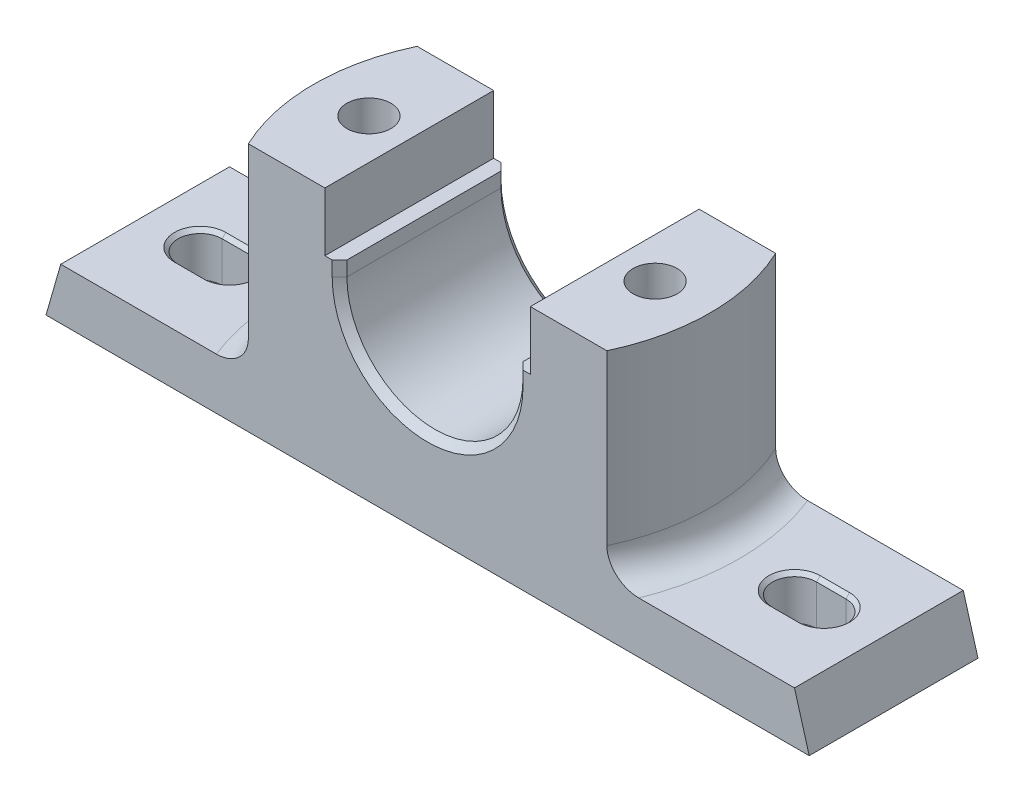
from build123d import *

# Parameters (mm, degrees)
BOSS_EXTRUDE1_DEPTH = 23
CUT_EXTRUDE1_DEPTH  = 76
CHAMFER1_SIZE       = 2
CUT_EXTRUDE2_START  = -68
SKETCH4_R           = 6
SKETCH4_W           = 28
SKETCH4_H           = 28
SKETCH4_W_2         = 3
CUT_EXTRUDE2_DEPTH  = 2
SKETCH4_3_R         = 6
CUT_EXTRUDE3_DEPTH  = 127.368508735
CUT_EXTRUDE4_START  = -66
SKETCH4_4_R         = 6
SKETCH4_4_W         = 28
SKETCH4_4_H         = 28
CUT_EXTRUDE4_DEPTH  = 10
CHAMFER2_SIZE       = 1
FILLET1_R           = 8


with BuildPart() as part:
    # Sketch1 → Boss-Extrude1 (new, symmetric)
    with BuildSketch(Plane.XY):
        with BuildLine():
            Line((-104, 0), (104, 0))
            Line((104, 0), (99.985564599, 14))
            Line((99.985564599, 14), (54, 14))
            Line((54, 14), (54, 68))
            Line((54, 68), (28, 68))
            Line((28, 68), (28, 52))
            Line((28, 52), (24, 52))
            Line((24, 52), (24, 48))
            ThreePointArc((24, 48), (0, 24), (-24, 48))
            Line((-24, 48), (-24, 52))
            Line((-24, 52), (-28, 52))
            Line((-28, 52), (-28, 68))
            Line((-28, 68), (-54, 68))
            Line((-54, 68), (-54, 14))
            Line((-54, 14), (-99.985564599, 14))
            Line((-99.985564599, 14), (-104, 0))
        make_face()
    extrude(amount=BOSS_EXTRUDE1_DEPTH, both=True)

    # Sketch3 → Cut-Extrude1 (cut)
    with BuildSketch(Plane(origin=(0, 14, 0), x_dir=(1, 0, 0), z_dir=(0, 1, 0))):
        with BuildLine():
            Line((-48.856934001, 23), (-54, 23))
            Line((-54, 23), (-54, 2.63e-07))
            ThreePointArc((-54, 2.63e-07), (-52.698550407, 11.784005473), (-48.856934001, 23))
        make_face()
        with BuildLine():
            ThreePointArc((-48.856934001, -23), (-52.698550464, -11.784005217), (-54, 2.63e-07))
            Line((-54, 2.63e-07), (-54, -23))
            Line((-54, -23), (-48.856934001, -23))
        make_face()
        with BuildLine():
            Line((48.856934001, -23), (54, -23))
            Line((54, -23), (54, 0))
            ThreePointArc((54, 0), (52.698550436, -11.784005345), (48.856934001, -23))
        make_face()
        with BuildLine():
            ThreePointArc((48.856934001, 23), (52.698550436, 11.784005345), (54, 0))
            Line((54, 0), (54, 23))
            Line((54, 23), (48.856934001, 23))
        make_face()
    extrude(amount=CUT_EXTRUDE1_DEPTH, mode=Mode.SUBTRACT)

    # Chamfer1
    chamfer1_edges = [part.edges().sort_by_distance(p)[0] for p in [
        (-24, 50, -23),
        (0, 24, -23),
        (24, 50, -23),
        (24, 50, 23),
        (0, 24, 23),
        (-24, 50, 23),
    ]]
    chamfer(chamfer1_edges, length=CHAMFER1_SIZE)

    # Sketch4 → Cut-Extrude2 (cut)
    # profile 1 of 14: a face of its own
    with BuildSketch(Plane(origin=(0, 68, 0), x_dir=(1, 0, 0), z_dir=(0, 1, 0)).offset(CUT_EXTRUDE2_START)):
        with BuildLine():
            Line((-53, 10.344080433), (-53, 14))
            Line((-53, 14), (-52.153619242, 14))
            ThreePointArc((-52.153619242, 14), (-51.649321328, 15.759048395), (-51.085712288, 17.5))
            Line((-51.085712288, 17.5), (-97.5, 17.5))
            Line((-97.5, 17.5), (-97.5, -17.5))
            Line((-97.5, -17.5), (-51.085712288, -17.5))
            ThreePointArc((-51.085712288, -17.5), (-51.649321328, -15.759048395), (-52.153619242, -14))
            Line((-52.153619242, -14), (-53, -14))
            Line((-53, -14), (-53, -10.344080433))
            ThreePointArc((-53, -10.344080433), (-54, 0), (-53, 10.344080433))
        make_face()
        with BuildLine():
            ThreePointArc((-85, -6), (-91, 0), (-85, 6))
            Line((-85, 6), (-77, 6))
            ThreePointArc((-77, 6), (-71, 0), (-77, -6))
            Line((-77, -6), (-85, -6))
        make_face(mode=Mode.SUBTRACT)
    # profile 2 of 14: a face of its own
    with BuildSketch(Plane(origin=(0, 68, 0), x_dir=(1, 0, 0), z_dir=(0, 1, 0)).offset(CUT_EXTRUDE2_START)):
        with BuildLine():
            Line((-28, 14), (-52.153619242, 14))
            ThreePointArc((-52.153619242, 14), (-52.608576743, 12.179394612), (-53, 10.344080433))
            Line((-53, 10.344080433), (-53, -10.344080433))
            ThreePointArc((-53, -10.344080433), (-52.608576743, -12.179394612), (-52.153619242, -14))
            Line((-52.153619242, -14), (-28, -14))
            Line((-28, -14), (-28, 14))
        make_face()
        with Locations((-39, 0)):
            Circle(SKETCH4_R, mode=Mode.SUBTRACT)
    # profile 3 of 14: a face of its own
    with BuildSketch(Plane(origin=(0, 68, 0), x_dir=(1, 0, 0), z_dir=(0, 1, 0)).offset(CUT_EXTRUDE2_START)):
        with Locations((-39, 0)):
            Circle(SKETCH4_R)
    # profile 4 of 14: a face of its own
    with BuildSketch(Plane(origin=(0, 68, 0), x_dir=(1, 0, 0), z_dir=(0, 1, 0)).offset(CUT_EXTRUDE2_START)):
        with BuildLine():
            Line((-85, -6), (-77, -6))
            ThreePointArc((-77, -6), (-71, 0), (-77, 6))
            Line((-77, 6), (-85, 6))
            ThreePointArc((-85, 6), (-91, 0), (-85, -6))
        make_face()
    # profile 5 of 14: a face of its own
    with BuildSketch(Plane(origin=(0, 68, 0), x_dir=(1, 0, 0), z_dir=(0, 1, 0)).offset(CUT_EXTRUDE2_START)):
        with BuildLine():
            Line((-28, -17.5), (-28, -14))
            Line((-28, -14), (-52.153619242, -14))
            ThreePointArc((-52.153619242, -14), (-51.649321328, -15.759048395), (-51.085712288, -17.5))
            Line((-51.085712288, -17.5), (-28, -17.5))
        make_face()
    # profile 6 of 14: a face of its own
    with BuildSketch(Plane(origin=(0, 68, 0), x_dir=(1, 0, 0), z_dir=(0, 1, 0)).offset(CUT_EXTRUDE2_START)):
        with BuildLine():
            ThreePointArc((-51.085712288, 17.5), (-51.649321328, 15.759048395), (-52.153619242, 14))
            Line((-52.153619242, 14), (-28, 14))
            Line((-28, 14), (-28, 17.5))
            Line((-28, 17.5), (-51.085712288, 17.5))
        make_face()
    # profile 7 of 14: a face of its own
    with BuildSketch(Plane(origin=(0, 68, 0), x_dir=(1, 0, 0), z_dir=(0, 1, 0)).offset(CUT_EXTRUDE2_START)):
        Polygon((-28, 17.5), (-28, 14), (-25, 14), (-25, -14), (-28, -14), (-28, -17.5), (97.5, -17.5), (97.5, 17.5), align=None)
        with Locations((39, 0)):
            Rectangle(SKETCH4_W, SKETCH4_H, mode=Mode.SUBTRACT)
        with BuildLine():
            Line((77, 6), (85, 6))
            ThreePointArc((85, 6), (91, 0), (85, -6))
            Line((85, -6), (77, -6))
            ThreePointArc((77, -6), (71, 0), (77, 6))
        make_face(mode=Mode.SUBTRACT)
    # profile 8 of 14: a face of its own
    with BuildSketch(Plane(origin=(0, 68, 0), x_dir=(1, 0, 0), z_dir=(0, 1, 0)).offset(CUT_EXTRUDE2_START)):
        with BuildLine():
            ThreePointArc((-52.153619242, -14), (-52.608576743, -12.179394612), (-53, -10.344080433))
            Line((-53, -10.344080433), (-53, -14))
            Line((-53, -14), (-52.153619242, -14))
        make_face()
    # profile 9 of 14: a face of its own
    with BuildSketch(Plane(origin=(0, 68, 0), x_dir=(1, 0, 0), z_dir=(0, 1, 0)).offset(CUT_EXTRUDE2_START)):
        with BuildLine():
            Line((-53, -10.344080433), (-53, 10.344080433))
            ThreePointArc((-53, 10.344080433), (-54, 0), (-53, -10.344080433))
        make_face()
    # profile 10 of 14: a face of its own
    with BuildSketch(Plane(origin=(0, 68, 0), x_dir=(1, 0, 0), z_dir=(0, 1, 0)).offset(CUT_EXTRUDE2_START)):
        with BuildLine():
            Line((-52.153619242, 14), (-53, 14))
            Line((-53, 14), (-53, 10.344080433))
            ThreePointArc((-53, 10.344080433), (-52.608576743, 12.179394612), (-52.153619242, 14))
        make_face()
    # profile 11 of 14: a face of its own
    with BuildSketch(Plane(origin=(0, 68, 0), x_dir=(1, 0, 0), z_dir=(0, 1, 0)).offset(CUT_EXTRUDE2_START)):
        with Locations((-26.5, 0)):
            Rectangle(SKETCH4_W_2, SKETCH4_H)
    # profile 12 of 14: a face of its own
    with BuildSketch(Plane(origin=(0, 68, 0), x_dir=(1, 0, 0), z_dir=(0, 1, 0)).offset(CUT_EXTRUDE2_START)):
        with BuildLine():
            ThreePointArc((77, -6), (71, 0), (77, 6))
            Line((77, 6), (85, 6))
            ThreePointArc((85, 6), (91, 0), (85, -6))
            Line((85, -6), (77, -6))
        make_face()
    # profile 13 of 14: a face of its own
    with BuildSketch(Plane(origin=(0, 68, 0), x_dir=(1, 0, 0), z_dir=(0, 1, 0)).offset(CUT_EXTRUDE2_START)):
        with Locations((39, 0)):
            Rectangle(SKETCH4_W, SKETCH4_H)
        with Locations((39, 0)):
            Circle(SKETCH4_R, mode=Mode.SUBTRACT)
    # profile 14 of 14: a face of its own
    with BuildSketch(Plane(origin=(0, 68, 0), x_dir=(1, 0, 0), z_dir=(0, 1, 0)).offset(CUT_EXTRUDE2_START)):
        with Locations((39, 0)):
            Circle(SKETCH4_R)
    extrude(amount=CUT_EXTRUDE2_DEPTH, mode=Mode.SUBTRACT)

    # Sketch4<3> → Cut-Extrude3 (cut, through all)
    with BuildSketch(Plane(origin=(0, 68, 0), x_dir=(1, 0, 0), z_dir=(0, 1, 0))):
        with Locations(Location((-39, 0, 0), (0, 0, 270))):
            Circle(SKETCH4_3_R)
        with Locations(Location((39, 0, 0), (0, 0, 270))):
            Circle(SKETCH4_3_R)
        with BuildLine():
            Line((-85, -6), (-77, -6))
            ThreePointArc((-77, -6), (-71, 0), (-77, 6))
            Line((-77, 6), (-85, 6))
            ThreePointArc((-85, 6), (-91, 0), (-85, -6))
        make_face()
        with BuildLine():
            ThreePointArc((77, -6), (71, 0), (77, 6))
            Line((77, 6), (85, 6))
            ThreePointArc((85, 6), (91, 0), (85, -6))
            Line((85, -6), (77, -6))
        make_face()
    extrude(amount=-CUT_EXTRUDE3_DEPTH, mode=Mode.SUBTRACT)

    # Sketch4<4> → Cut-Extrude4 (cut)
    # profile 1 of 4: a face of its own
    with BuildSketch(Plane(origin=(0, 68, 0), x_dir=(1, 0, 0), z_dir=(0, 1, 0)).offset(CUT_EXTRUDE4_START)):
        with BuildLine():
            Line((-28, 14), (-52.153619242, 14))
            ThreePointArc((-52.153619242, 14), (-52.608576743, 12.179394612), (-53, 10.344080433))
            Line((-53, 10.344080433), (-53, -10.344080433))
            ThreePointArc((-53, -10.344080433), (-52.608576743, -12.179394612), (-52.153619242, -14))
            Line((-52.153619242, -14), (-28, -14))
            Line((-28, -14), (-28, 14))
        make_face()
        with Locations(Location((-39, 0, 0), (0, 0, 270))):
            Circle(SKETCH4_4_R, mode=Mode.SUBTRACT)
    # profile 2 of 4: a face of its own
    with BuildSketch(Plane(origin=(0, 68, 0), x_dir=(1, 0, 0), z_dir=(0, 1, 0)).offset(CUT_EXTRUDE4_START)):
        with Locations((39, 0)):
            Rectangle(SKETCH4_4_W, SKETCH4_4_H)
        with Locations(Location((39, 0, 0), (0, 0, 270))):
            Circle(SKETCH4_4_R, mode=Mode.SUBTRACT)
    # profile 3 of 4: a face of its own
    with BuildSketch(Plane(origin=(0, 68, 0), x_dir=(1, 0, 0), z_dir=(0, 1, 0)).offset(CUT_EXTRUDE4_START)):
        with Locations(Location((-39, 0, 0), (0, 0, 270))):
            Circle(SKETCH4_4_R)
    # profile 4 of 4: a face of its own
    with BuildSketch(Plane(origin=(0, 68, 0), x_dir=(1, 0, 0), z_dir=(0, 1, 0)).offset(CUT_EXTRUDE4_START)):
        with Locations(Location((39, 0, 0), (0, 0, 270))):
            Circle(SKETCH4_4_R)
    extrude(amount=CUT_EXTRUDE4_DEPTH, mode=Mode.SUBTRACT)

    # Chamfer2
    chamfer2_edges = [part.edges().sort_by_distance(p)[0] for p in [
        (71, 14, 0),
        (81, 14, -6),
        (91, 14, 0),
        (81, 14, 6),
        (-81, 14, 6),
        (-91, 14, 0),
        (-81, 14, -6),
        (-71, 14, 0),
    ]]
    chamfer(chamfer2_edges, length=CHAMFER2_SIZE)

    # Fillet1
    fillet1_edges = [part.edges().sort_by_distance(p)[0] for p in [
        (-54, 14, 0),
        (54, 14, 0),
    ]]
    fillet(fillet1_edges, radius=FILLET1_R)


solid = part.part
